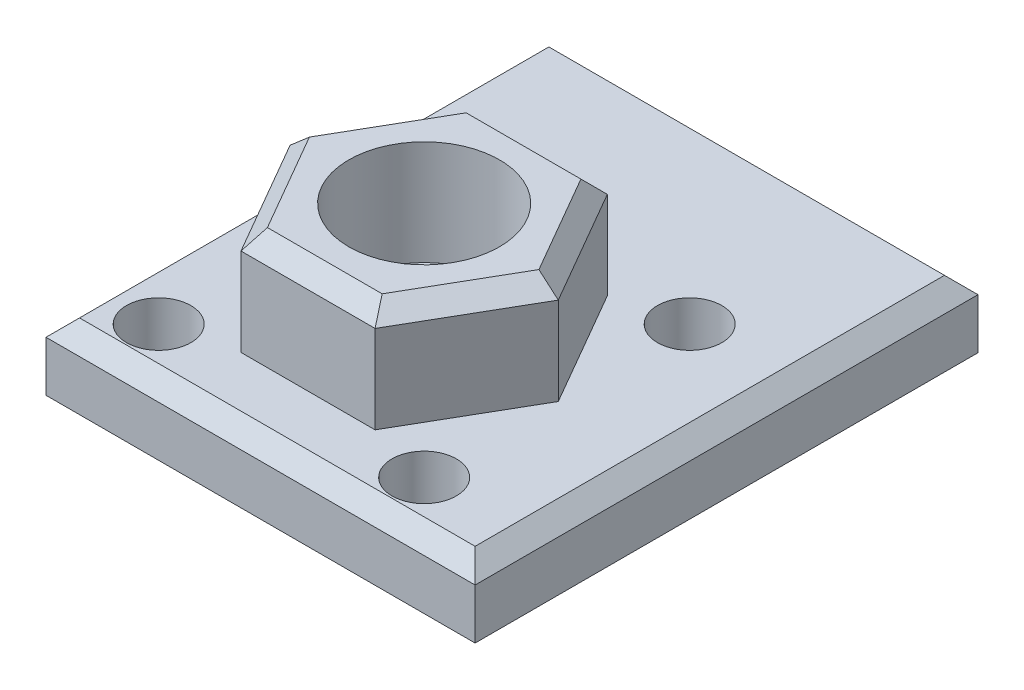
from build123d import *

# Parameters (mm, degrees)
SKETCH1_W           = 40.64
SKETCH1_H           = 47.625
SKETCH1_R           = 3.048
BOSS_EXTRUDE1_DEPTH = 6.35
BOSS_EXTRUDE2_DEPTH = 9.906
SKETCH3_R           = 4.826
CUT_EXTRUDE1_DEPTH  = 76.04657711
SKETCH4_R           = 7.1374
CUT_EXTRUDE2_DEPTH  = 9.906
CHAMFER1_SIZE       = 1.5875


with BuildPart() as part:
    # Sketch1 → Boss-Extrude1 (new body)
    with BuildSketch(Plane(origin=(0, 0, 0), x_dir=(1, 0, 0), z_dir=(0, 1, 0))):
        with Locations((20.32, 37.1475)):
            Rectangle(SKETCH1_W, SKETCH1_H)
        with Locations(Location((30.987358569, 18.161641431, 0), (0, 0, 270))):
            Circle(SKETCH1_R, mode=Mode.SUBTRACT)
        with Locations(Location((30.987358569, 43.306358569, 0), (0, 0, 270))):
            Circle(SKETCH1_R, mode=Mode.SUBTRACT)
        with Locations(Location((5.842641431, 18.161641431, 0), (0, 0, 270))):
            Circle(SKETCH1_R, mode=Mode.SUBTRACT)
        with Locations(Location((5.842641431, 43.306358569, 0), (0, 0, 270))):
            Circle(SKETCH1_R, mode=Mode.SUBTRACT)
    extrude(amount=BOSS_EXTRUDE1_DEPTH)

    # Sketch2 → Boss-Extrude2 (add)
    with BuildSketch(Plane(origin=(0, 6.35, 0), x_dir=(1, 0, 0), z_dir=(0, 1, 0))):
        Polygon((31.115, 30.734), (24.765, 41.732522628), (12.065, 41.732522628), (5.715, 30.734), (12.065, 19.735477372), (24.765, 19.735477372), align=None)
    extrude(amount=BOSS_EXTRUDE2_DEPTH)

    # Sketch3 → Cut-Extrude1 (cut, through all)
    with BuildSketch(Plane(origin=(0, 16.256, 0), x_dir=(1, 0, 0), z_dir=(0, 1, 0))):
        with Locations(Location((18.415, 30.734, 0), (0, 0, 270))):
            Circle(SKETCH3_R)
    extrude(amount=-CUT_EXTRUDE1_DEPTH, mode=Mode.SUBTRACT)

    # Sketch4 → Cut-Extrude2 (cut)
    with BuildSketch(Plane(origin=(0, 16.256, 0), x_dir=(1, 0, 0), z_dir=(0, 1, 0))):
        with Locations(Location((18.415, 30.734, 0), (0, 0, 270))):
            Circle(SKETCH4_R)
    extrude(amount=-CUT_EXTRUDE2_DEPTH, mode=Mode.SUBTRACT)

    # Chamfer1
    chamfer1_edges = [part.edges().sort_by_distance(p)[0] for p in [
        (20.32, 6.35, -60.96),
        (0, 6.35, -37.1475),
        (27.94, 16.256, -25.234738686),
        (27.94, 16.256, -36.233261314),
        (18.415, 16.256, -41.732522628),
        (8.89, 16.256, -36.233261314),
        (8.89, 16.256, -25.234738686),
        (18.415, 16.256, -19.735477372),
        (20.32, 6.35, -13.335),
        (40.64, 6.35, -37.1475),
    ]]
    chamfer(chamfer1_edges, length=CHAMFER1_SIZE)


solid = part.part
